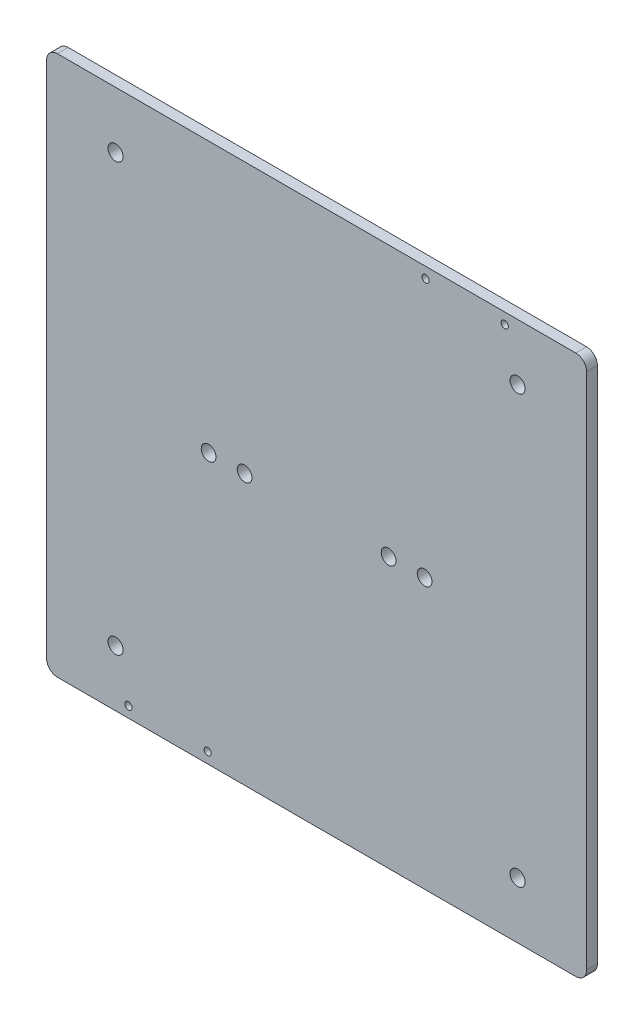
from build123d import *

# Parameters (mm, degrees)
SKETCH1_W           = 150
SKETCH1_H           = 150
BOSS_EXTRUDE1_DEPTH = 3
FILLET1_R           = 3
SKETCH2_R           = 2.1
CUT_EXTRUDE1_DEPTH  = 3
SKETCH3_R           = 1
CUT_EXTRUDE2_DEPTH  = 3
CUT_EXTRUDE_1_REACH = 108.108
SKETCH_2_R          = 2.05


with BuildPart() as part:
    # Sketch1 → Boss-Extrude1 (new body)
    with BuildSketch(Plane.XY):
        Rectangle(SKETCH1_W, SKETCH1_H)
    extrude(amount=BOSS_EXTRUDE1_DEPTH)

    # Fillet1
    fillet1_edges = [part.edges().sort_by_distance(p)[0] for p in [
        (75, -75, 1.5),
        (-75, -75, 1.5),
        (-75, 75, 1.5),
        (75, 75, 1.5),
    ]]
    fillet(fillet1_edges, radius=FILLET1_R)

    # Sketch2 → Cut-Extrude1 (cut)
    with BuildSketch(Plane(origin=(0, 0, 0), x_dir=(-1, 0, 0), z_dir=(0, 0, -1))):
        with Locations((-55.835, 59.325)):
            Circle(SKETCH2_R)
        with Locations((55.835, 59.325)):
            Circle(SKETCH2_R)
        with Locations((-55.835, -59.325)):
            Circle(SKETCH2_R)
        with Locations((55.835, -59.325)):
            Circle(SKETCH2_R)
    extrude(amount=-CUT_EXTRUDE1_DEPTH, mode=Mode.SUBTRACT)

    # Sketch3 → Cut-Extrude2 (cut)
    with BuildSketch(Plane(origin=(0, 0, 0), x_dir=(-1, 0, 0), z_dir=(0, 0, -1))):
        with Locations((-52.26, 72)):
            Circle(SKETCH3_R)
        with Locations((-30.26, 72)):
            Circle(SKETCH3_R)
        with Locations((52.26, -72)):
            Circle(SKETCH3_R)
        with Locations((30.26, -72)):
            Circle(SKETCH3_R)
    extrude(amount=-CUT_EXTRUDE2_DEPTH, mode=Mode.SUBTRACT)

    # 草图2 → 切除-拉伸1 (cut, up to next)
    with BuildSketch(Plane.XY.offset(3), mode=Mode.PRIVATE) as cut_extrude_1_sk1:
        with Locations((-30, 0)):
            Circle(SKETCH_2_R)
    cut_extrude_1_tool1 = extrude(cut_extrude_1_sk1.sketch, amount=-CUT_EXTRUDE_1_REACH, mode=Mode.PRIVATE) & part.part
    # 草图2 → 切除-拉伸1 (cut, up to next)
    with BuildSketch(Plane.XY.offset(3), mode=Mode.PRIVATE) as cut_extrude_1_sk2:
        with Locations((-20, 0)):
            Circle(SKETCH_2_R)
    cut_extrude_1_tool2 = extrude(cut_extrude_1_sk2.sketch, amount=-CUT_EXTRUDE_1_REACH, mode=Mode.PRIVATE) & part.part
    # 草图2 → 切除-拉伸1 (cut, up to next)
    with BuildSketch(Plane.XY.offset(3), mode=Mode.PRIVATE) as cut_extrude_1_sk3:
        with Locations((30, 0)):
            Circle(SKETCH_2_R)
    cut_extrude_1_tool3 = extrude(cut_extrude_1_sk3.sketch, amount=-CUT_EXTRUDE_1_REACH, mode=Mode.PRIVATE) & part.part
    # 草图2 → 切除-拉伸1 (cut, up to next)
    with BuildSketch(Plane.XY.offset(3), mode=Mode.PRIVATE) as cut_extrude_1_sk4:
        with Locations((20, 0)):
            Circle(SKETCH_2_R)
    cut_extrude_1_tool4 = extrude(cut_extrude_1_sk4.sketch, amount=-CUT_EXTRUDE_1_REACH, mode=Mode.PRIVATE) & part.part
    add(cut_extrude_1_tool1.solids().sort_by_distance((-30, 0, 3))[0], mode=Mode.SUBTRACT)
    add(cut_extrude_1_tool2.solids().sort_by_distance((-20, 0, 3))[0], mode=Mode.SUBTRACT)
    add(cut_extrude_1_tool3.solids().sort_by_distance((30, 0, 3))[0], mode=Mode.SUBTRACT)
    add(cut_extrude_1_tool4.solids().sort_by_distance((20, 0, 3))[0], mode=Mode.SUBTRACT)


solid = part.part
